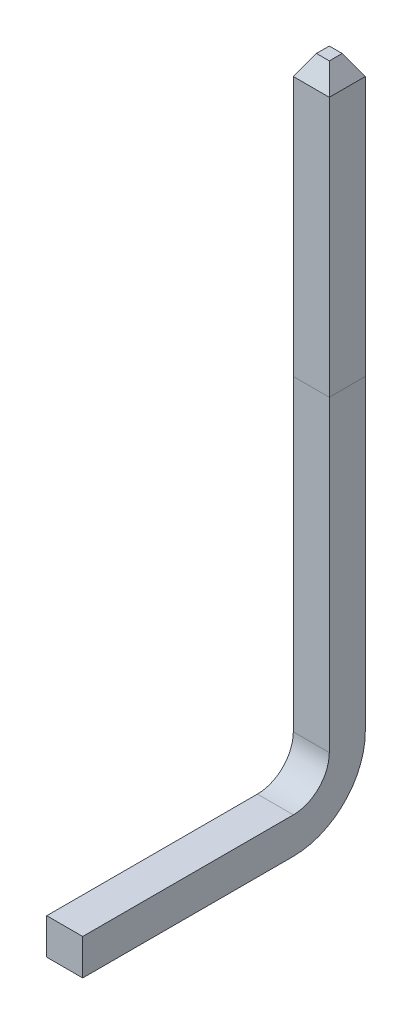
from build123d import *
from OCP.BRepFilletAPI import BRepFilletAPI_MakeChamfer

# Parameters (mm, degrees)
BOSS_EXTRUDE1_DEPTH = 1.143
CHAMFER1_SIZE       = 0.635
CHAMFER1_SIZE2      = 0.366617421
SCALE1_SCALE        = 0.654


with BuildPart() as part:
    # Sketch1 → Boss-Extrude1 (new body)
    with BuildSketch(Plane(origin=(0, 0, 0), x_dir=(0, 0, -1), z_dir=(1, 0, 0))):
        with BuildLine():
            Line((8.9789, 2.286), (8.9789, 20.955))
            Line((8.9789, 20.955), (7.8359, 20.955))
            Line((7.8359, 20.955), (7.8359, 2.286))
            ThreePointArc((7.8359, 2.286), (7.501123051, 1.477776949), (6.6929, 1.143))
            Line((6.6929, 1.143), (0, 1.143))
            Line((0, 1.143), (0, 0))
            Line((0, 0), (6.6929, 0))
            ThreePointArc((6.6929, 0), (8.309346102, 0.669553898), (8.9789, 2.286))
        make_face()
    extrude(amount=BOSS_EXTRUDE1_DEPTH)

    # Chamfer1: one chamfer whose edges measure the first distance from different faces: ONE call of the kernel's chamfer builder (chamfer() names one face for all edges)
    chamfer1_edges_1 = [part.edges().sort_by_distance(p)[0] for p in [
        (0.5715, 20.955, -8.9789),
    ]]
    chamfer1_side_1 = [part.faces().sort_by_distance(p)[0] for p in [
        (0.5715, 11.6205, -8.9789),
    ]]
    chamfer1_edges_2 = [part.edges().sort_by_distance(p)[0] for p in [
        (1.143, 20.955, -8.4074),
    ]]
    chamfer1_side_2 = [part.faces().sort_by_distance(p)[0] for p in [
        (1.143, 0.8307576, -8.1481424),
    ]]
    chamfer1_edges_3 = [part.edges().sort_by_distance(p)[0] for p in [
        (0.5715, 20.955, -7.8359),
    ]]
    chamfer1_side_3 = [part.faces().sort_by_distance(p)[0] for p in [
        (0.5715, 11.6205, -7.8359),
    ]]
    chamfer1_edges_4 = [part.edges().sort_by_distance(p)[0] for p in [
        (0, 20.955, -8.4074),
    ]]
    chamfer1_side_4 = [part.faces().sort_by_distance(p)[0] for p in [
        (0, 0.8307576, -8.1481424),
    ]]
    chamfer1 = BRepFilletAPI_MakeChamfer(part.part.solid().wrapped)
    for e in chamfer1_edges_1:
        chamfer1.Add(CHAMFER1_SIZE, CHAMFER1_SIZE2, e.wrapped, chamfer1_side_1[0].wrapped)  # the first distance lies on this face
    for e in chamfer1_edges_2:
        chamfer1.Add(CHAMFER1_SIZE, CHAMFER1_SIZE2, e.wrapped, chamfer1_side_2[0].wrapped)  # the first distance lies on this face
    for e in chamfer1_edges_3:
        chamfer1.Add(CHAMFER1_SIZE, CHAMFER1_SIZE2, e.wrapped, chamfer1_side_3[0].wrapped)  # the first distance lies on this face
    for e in chamfer1_edges_4:
        chamfer1.Add(CHAMFER1_SIZE, CHAMFER1_SIZE2, e.wrapped, chamfer1_side_4[0].wrapped)  # the first distance lies on this face
    add(Compound.cast(chamfer1.Shape()), mode=Mode.REPLACE)


with BuildPart() as part_1:
    # Scale1: scaled about (0.5715, 7.832685678, -7.129530876)
    add(part.part.scale(SCALE1_SCALE).moved(Location((0.197739, 2.710109245, -2.466817683))))


solid = part_1.part
